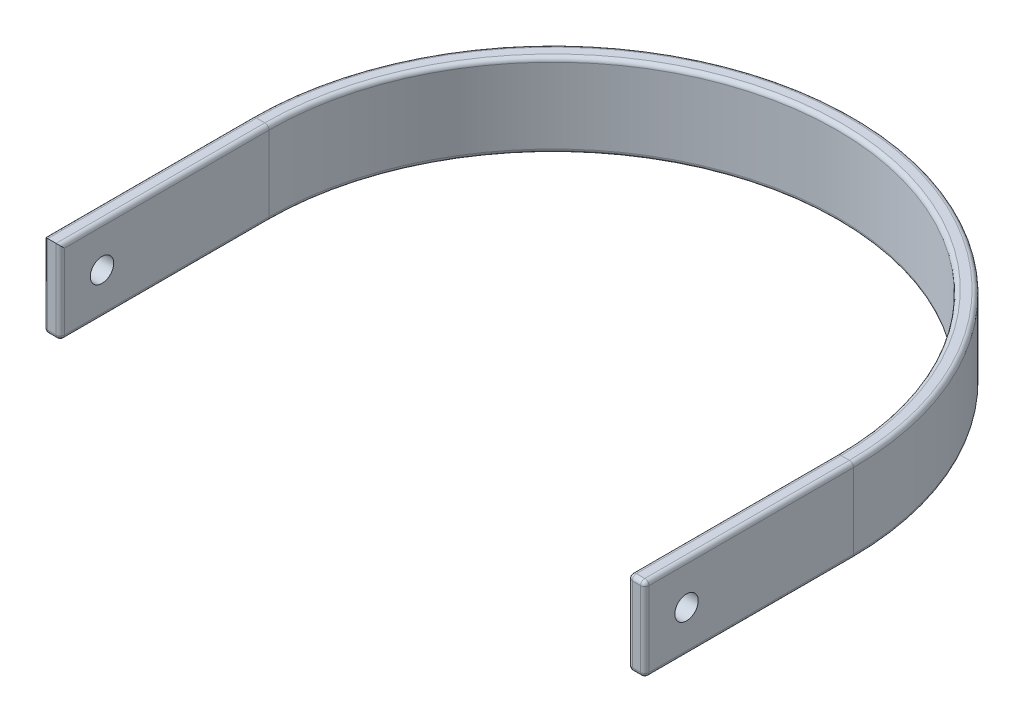
from build123d import *

# Parameters (mm, degrees)
SZKIC3_W                   = 2
SZKIC3_H                   = 10
SZKIC5_R                   = 1.4
WYTNIJ_WYCI_GNI_CIE1_DEPTH = 100
ZAOKR_GLENIE1_R            = 0.5


with BuildPart() as part:
    # Wyciągnięcie po ścieżce1: sweep along a path in Szkic2
    with BuildLine(Plane(origin=(0, 0, 0), x_dir=(1, 0, 0), z_dir=(0, 1, 0))) as wyci_gni_cie_po_cie_ce1_path:
        Line((0, 0), (0, 25))
        ThreePointArc((0, 25), (35, 60), (70, 25))
        Line((70, 25), (70, 0))
    # Szkic3 → Wyciągnięcie po ścieżce1 (sweep)
    with BuildSketch(Plane.XY):
        Rectangle(SZKIC3_W, SZKIC3_H)
    sweep(path=wyci_gni_cie_po_cie_ce1_path.line)

    # Szkic5 → Wytnij-wyciągnięcie1 (cut)
    with BuildSketch(Plane.ZY.offset(1)):
        with Locations(Location((-5, 0, 0), (0, 0, 270))):
            Circle(SZKIC5_R)
    extrude(amount=-WYTNIJ_WYCI_GNI_CIE1_DEPTH, mode=Mode.SUBTRACT)

    # Zaokrąglenie1
    zaokr_glenie1_edges = [part.edges().sort_by_distance(p)[0] for p in [
        (35, -5, -61),
        (35, 5, -61),
        (1, 0, 0),
        (-1, 0, 0),
        (0, -5, 0),
        (1, -5, -12.5),
        (35, -5, -59),
        (70, -5, 0),
        (71, -5, -12.5),
        (71, 0, 0),
        (71, 5, -12.5),
        (70, 5, 0),
        (69, 0, 0),
        (69, -5, -12.5),
        (69, 5, -12.5),
        (-1, -5, -12.5),
        (35, 5, -59),
        (1, 5, -12.5),
        (-1, 5, -12.5),
    ]]
    fillet(zaokr_glenie1_edges, radius=ZAOKR_GLENIE1_R)


solid = part.part
